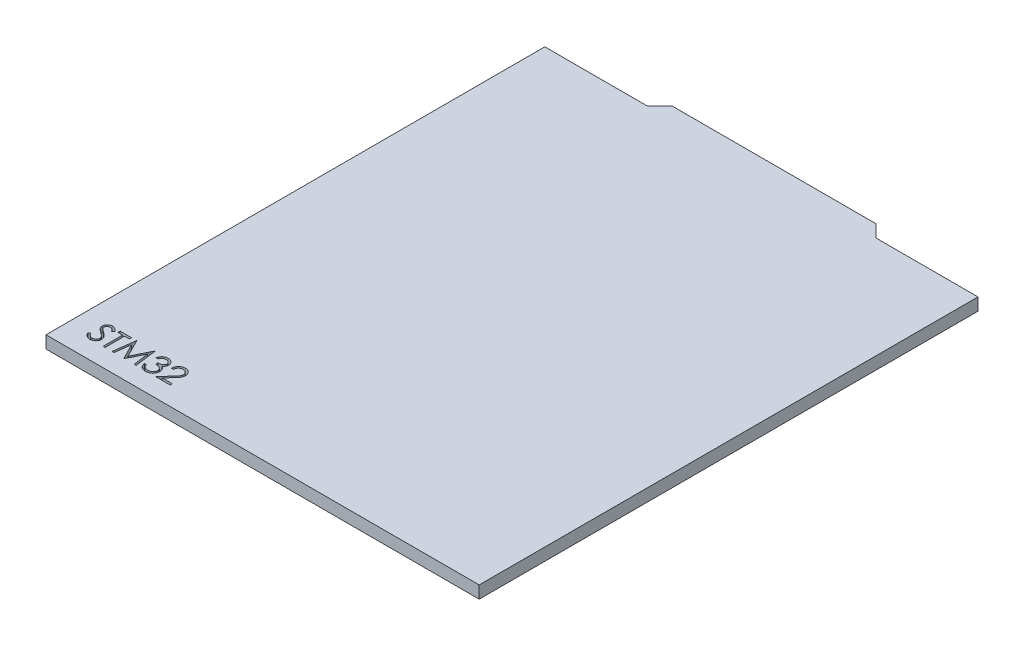
from build123d import *

# Parameters (mm, degrees)
BOSS_EXTRUDE1_DEPTH = 2
CUT_EXTRUDE1_DEPTH  = 1


with BuildPart() as part:
    # Sketch1 → Boss-Extrude1 (new body)
    with BuildSketch(Plane(origin=(0, 0, 0), x_dir=(1, 0, 0), z_dir=(0, 1, 0))):
        Polygon((16.5, 80.6), (18.5, 82.6), (51.5, 82.6), (53.5, 80.6), (70, 80.6), (70, 0), (0, 0), (0, 80.6), align=None)
    extrude(amount=BOSS_EXTRUDE1_DEPTH)

    # Sketch2 → Cut-Extrude1 (cut)
    with BuildSketch(Plane(origin=(0, 2, 0), x_dir=(1, 0, 0), z_dir=(0, 1, 0))):
        with BuildLine():
            Line((3.08974359, 3.675180288), (3.385616987, 3.852564103))
            add(Edge.make_bspline(
                [(3.385616987, 3.852564103), (3.413135224, 3.806499718), (3.465859105, 3.718242134), (3.553810464, 3.598984093), (3.644943375, 3.497621937), (3.739932709, 3.414745329), (3.838198657, 3.349496442), (3.940382711, 3.303294211), (4.046140521, 3.274478235), (4.118114343, 3.270978149), (4.154046474, 3.269230769)],
                knots=[0, 0, 0, 0, 1.272034388, 2.437168799, 3.508375237, 4.49857839, 5.41946034, 6.295179144, 7.148887113, 8, 8, 8, 8], degree=3))
            add(Edge.make_bspline(
                [(4.154046474, 3.269230769), (4.184733335, 3.270085442), (4.245570108, 3.271779832), (4.335132351, 3.288060634), (4.422114153, 3.313072763), (4.504722791, 3.348893694), (4.581818405, 3.39223218), (4.649425101, 3.444578358), (4.707871214, 3.503184563), (4.755680328, 3.568567218), (4.792360364, 3.638884367), (4.820552432, 3.711060318), (4.836197506, 3.786228886), (4.838554259, 3.836839349), (4.83974359, 3.862379808)],
                knots=[0, 0, 0, 0, 1.095163259, 2.171163733, 3.241058638, 4.321873601, 5.38011039, 6.391990106, 7.366004449, 8.327778327, 9.272591725, 10.192022065, 11.087607919, 12, 12, 12, 12], degree=3))
            add(Edge.make_bspline(
                [(4.83974359, 3.862379808), (4.838269279, 3.891520657), (4.835272221, 3.950759747), (4.809940741, 4.0381594), (4.770091494, 4.12465197), (4.73332885, 4.178153235), (4.714242788, 4.205929487)],
                knots=[0, 0, 0, 0, 0.938893495, 1.908633276, 2.914225137, 4, 4, 4, 4], degree=3))
            add(Edge.make_bspline(
                [(4.714242788, 4.205929487), (4.698572174, 4.225976311), (4.66567368, 4.268062109), (4.609116167, 4.330707345), (4.542750053, 4.395325764), (4.468846498, 4.464384821), (4.384713409, 4.534672617), (4.292985895, 4.609540895), (4.191322036, 4.686142472), (4.120022539, 4.737515038), (4.083233173, 4.764022436)],
                knots=[0, 0, 0, 0, 0.722233717, 1.516239348, 2.393582979, 3.351407094, 4.387010283, 5.505090956, 6.712668013, 8, 8, 8, 8], degree=3))
            add(Edge.make_bspline(
                [(4.083233173, 4.764022436), (4.046409177, 4.790251024), (3.9760045, 4.840398086), (3.877545918, 4.91482237), (3.789501455, 4.982866239), (3.712262438, 5.045170251), (3.645862842, 5.101742856), (3.589779431, 5.152040795), (3.545440873, 5.197424356), (3.520785293, 5.226865698), (3.509715545, 5.240084135)],
                knots=[0, 0, 0, 0, 1.452282411, 2.77665338, 3.964542531, 5.026858415, 5.96415736, 6.766646006, 7.446254459, 8, 8, 8, 8], degree=3))
            add(Edge.make_bspline(
                [(3.509715545, 5.240084135), (3.494243, 5.260685171), (3.463814163, 5.301199875), (3.423648157, 5.364524733), (3.389508995, 5.429347998), (3.362746663, 5.495843863), (3.340210444, 5.563078792), (3.325052513, 5.631930038), (3.315561116, 5.702088656), (3.31458913, 5.749302157), (3.314102564, 5.772936699)],
                knots=[0, 0, 0, 0, 1.068054152, 2.10047183, 3.106115577, 4.101338837, 5.06977816, 6.043150881, 7.020423561, 8, 8, 8, 8], degree=3))
            add(Edge.make_bspline(
                [(3.314102564, 5.772936699), (3.315407773, 5.809966473), (3.317990293, 5.883234537), (3.33983081, 5.990265367), (3.374303704, 6.092451785), (3.422598592, 6.188782118), (3.484855945, 6.276748099), (3.556901919, 6.357361586), (3.642713405, 6.425130168), (3.736866029, 6.484342227), (3.839922401, 6.530688152), (3.947913304, 6.565649132), (4.061010376, 6.58545839), (4.137613511, 6.588301155), (4.176482372, 6.58974359)],
                knots=[0, 0, 0, 0, 1.005424448, 1.989358655, 2.955360095, 3.929531133, 4.905563448, 5.876582895, 6.856512386, 7.866279853, 8.892233794, 9.918561126, 10.94386622, 12, 12, 12, 12], degree=3))
            add(Edge.make_bspline(
                [(4.176482372, 6.58974359), (4.217726472, 6.588321038), (4.299747824, 6.585492037), (4.420397039, 6.560894506), (4.536557756, 6.520193834), (4.630001021, 6.474005176), (4.703133782, 6.42787376), (4.758906515, 6.385853936), (4.815423966, 6.337478827), (4.87314202, 6.282619581), (4.93108268, 6.22077283), (4.990106132, 6.152362141), (5.050350401, 6.077805585), (5.089106261, 6.024581085), (5.108974359, 5.997295673)],
                knots=[0, 0, 0, 0, 1.286793592, 2.559021753, 3.825965368, 5.121522368, 5.803751409, 6.523245864, 7.299691795, 8.125521123, 9.008227632, 9.944561021, 10.946284179, 12, 12, 12, 12], degree=3))
            Line((5.108974359, 5.997295673), (4.825020032, 5.782051282))
            add(Edge.make_bspline(
                [(4.825020032, 5.782051282), (4.8078741, 5.804139972), (4.774855043, 5.846677626), (4.724725556, 5.906248941), (4.677476908, 5.960665421), (4.630926508, 6.007930549), (4.587532876, 6.050632682), (4.545415834, 6.087192439), (4.505181483, 6.117968034), (4.454464572, 6.150811594), (4.390746854, 6.183368098), (4.310762318, 6.210917176), (4.227176043, 6.227472238), (4.170246411, 6.229661126), (4.141426282, 6.230769231)],
                knots=[0, 0, 0, 0, 1.181633172, 2.275549214, 3.290209073, 4.226197932, 5.078386478, 5.862611352, 6.581680152, 7.217281963, 8.414376989, 9.595101626, 10.782541182, 12, 12, 12, 12], degree=3))
            add(Edge.make_bspline(
                [(4.141426282, 6.230769231), (4.10526976, 6.229557531), (4.035545312, 6.227220882), (3.936555076, 6.201700896), (3.847461151, 6.161519036), (3.770908586, 6.105204058), (3.707171609, 6.038483065), (3.66106615, 5.96170421), (3.633315986, 5.876921808), (3.629929706, 5.817780151), (3.628205128, 5.787660256)],
                knots=[0, 0, 0, 0, 1.14458467, 2.207223713, 3.21896685, 4.227309161, 5.202851033, 6.127160689, 7.046193047, 8, 8, 8, 8], degree=3))
            add(Edge.make_bspline(
                [(3.628205128, 5.787660256), (3.628598255, 5.768908778), (3.629385151, 5.731375158), (3.640359949, 5.675923736), (3.654459278, 5.620612397), (3.676801909, 5.565689814), (3.707647213, 5.510195455), (3.748152389, 5.453173718), (3.799165701, 5.394122009), (3.838242713, 5.355714635), (3.858874199, 5.335436699)],
                knots=[0, 0, 0, 0, 0.858281714, 1.717966888, 2.583508476, 3.4729293, 4.427298488, 5.488583878, 6.674047936, 8, 8, 8, 8], degree=3))
            add(Edge.make_bspline(
                [(3.858874199, 5.335436699), (3.866535571, 5.328599673), (3.884737238, 5.312356465), (3.918013164, 5.285764184), (3.961955962, 5.252961412), (4.015418163, 5.212374095), (4.079385525, 5.165292633), (4.153865081, 5.112319021), (4.238026614, 5.051733562), (4.29774853, 5.009376021), (4.329326923, 4.986979167)],
                knots=[0, 0, 0, 0, 0.420754252, 0.999615792, 1.744751191, 2.668019286, 3.750313428, 4.999500688, 6.413464383, 8, 8, 8, 8], degree=3))
            add(Edge.make_bspline(
                [(4.329326923, 4.986979167), (4.367312836, 4.959337807), (4.440867293, 4.905814145), (4.545524873, 4.825398465), (4.640418681, 4.746750697), (4.725881884, 4.67037309), (4.802758793, 4.596844997), (4.870196513, 4.525281816), (4.928882194, 4.456196244), (4.992061412, 4.367623668), (5.056619232, 4.258842584), (5.112060739, 4.125564345), (5.147019087, 3.991768025), (5.151590602, 3.901841188), (5.153846154, 3.857471955)],
                knots=[0, 0, 0, 0, 1.163667725, 2.253281268, 3.268753668, 4.215851969, 5.092017293, 5.902905408, 6.650798638, 7.335211899, 8.59617414, 9.77448103, 10.901945474, 12, 12, 12, 12], degree=3))
            add(Edge.make_bspline(
                [(5.153846154, 3.857471955), (5.153189016, 3.82609359), (5.151887501, 3.763946206), (5.136926587, 3.67269113), (5.115006922, 3.58406026), (5.081969688, 3.499149147), (5.04164653, 3.416404385), (4.990480282, 3.337996484), (4.931172597, 3.262190086), (4.863138832, 3.191006594), (4.78869293, 3.125660398), (4.710009235, 3.067531337), (4.626958962, 3.019063014), (4.539992645, 2.979512172), (4.449090309, 2.948578654), (4.354282525, 2.926165785), (4.255413014, 2.912410074), (4.188212532, 2.910982313), (4.154046474, 2.91025641)],
                knots=[0, 0, 0, 0, 0.983748083, 1.948392443, 2.894712957, 3.844097841, 4.80183111, 5.778335162, 6.776009319, 7.81870978, 8.863265674, 9.881300176, 10.883814829, 11.87499822, 12.874611388, 13.892143829, 14.928324115, 16, 16, 16, 16], degree=3))
            add(Edge.make_bspline(
                [(4.154046474, 2.91025641), (4.127611131, 2.910767592), (4.075073371, 2.911783517), (3.997363889, 2.920764798), (3.9212243, 2.933471901), (3.847610018, 2.953645971), (3.775572607, 2.978122948), (3.705425372, 3.008261281), (3.637134318, 3.044378482), (3.570316735, 3.085673507), (3.505142561, 3.133731252), (3.442223093, 3.189704748), (3.379493907, 3.252050253), (3.318806511, 3.322460816), (3.258933367, 3.399798899), (3.201054957, 3.484788083), (3.143973239, 3.576965436), (3.108157772, 3.641830522), (3.08974359, 3.675180288)],
                knots=[0, 0, 0, 0, 0.915332311, 1.819136955, 2.706846663, 3.586547465, 4.459518054, 5.340707479, 6.227863349, 7.133153174, 8.059268498, 9.028702269, 10.047606654, 11.120612155, 12.245963614, 13.433783089, 14.680604001, 16, 16, 16, 16], degree=3))
        make_face()
        Polygon((5.467948718, 6.141025641), (5.467948718, 6.5), (7.307692308, 6.5), (7.307692308, 6.141025641), (6.544871795, 6.141025641), (6.544871795, 3), (6.230769231, 3), (6.230769231, 6.141025641), align=None)
        Polygon((7.666666667, 3), (8.128705929, 6.5), (8.173577724, 6.5), (9.618589744, 3.628205128), (11.059395032, 6.5), (11.104266827, 6.5), (11.570512821, 3), (11.256410256, 3), (10.919871795, 5.516326122), (9.657151442, 3), (9.585637019, 3), (8.317307692, 5.524038462), (7.982872596, 3), align=None)
        with BuildLine():
            Line((12.423076923, 5.692307692), (12.108974359, 5.692307692))
            add(Edge.make_bspline(
                [(12.108974359, 5.692307692), (12.11748391, 5.727540176), (12.134119385, 5.796416801), (12.168816959, 5.894824062), (12.206616214, 5.987947583), (12.252005318, 6.074043657), (12.301514073, 6.154842559), (12.358236794, 6.228511684), (12.419556517, 6.296924649), (12.487381466, 6.357637887), (12.558510128, 6.412615616), (12.633944747, 6.459490673), (12.712167641, 6.499814826), (12.793720774, 6.533035058), (12.878846946, 6.558060582), (12.966776569, 6.576217387), (13.057740069, 6.588008502), (13.11948766, 6.589159265), (13.150841346, 6.58974359)],
                knots=[0, 0, 0, 0, 1.162005537, 2.271625781, 3.343758855, 4.383309926, 5.390229558, 6.379919256, 7.361854164, 8.333198761, 9.295911338, 10.242430842, 11.177959212, 12.116337295, 13.062827104, 14.020064771, 14.994644689, 16, 16, 16, 16], degree=3))
            add(Edge.make_bspline(
                [(13.150841346, 6.58974359), (13.196524088, 6.588364359), (13.286893099, 6.585635984), (13.419656146, 6.560721548), (13.547682965, 6.521296415), (13.669572213, 6.466822688), (13.782790646, 6.399635375), (13.883526832, 6.319670638), (13.970415343, 6.228471337), (14.043309721, 6.127738772), (14.10038472, 6.020083263), (14.142471093, 5.909283106), (14.168092774, 5.795601134), (14.171413331, 5.718843855), (14.173076923, 5.680388622)],
                knots=[0, 0, 0, 0, 1.083050992, 2.142477498, 3.193116406, 4.255571735, 5.30263384, 6.308962982, 7.297363603, 8.282367274, 9.249857812, 10.179914175, 11.08814088, 12, 12, 12, 12], degree=3))
            add(Edge.make_bspline(
                [(14.173076923, 5.680388622), (14.171913332, 5.643381827), (14.169636365, 5.570965273), (14.150302659, 5.465243775), (14.117766396, 5.365602175), (14.072696634, 5.271621013), (14.014355084, 5.183896173), (13.943682387, 5.102230282), (13.860179725, 5.026261124), (13.796900787, 4.982741651), (13.764322917, 4.960336538)],
                knots=[0, 0, 0, 0, 1.024540389, 2.004866551, 2.965041327, 3.920577974, 4.882998113, 5.874504559, 6.905732034, 8, 8, 8, 8], degree=3))
            add(Edge.make_bspline(
                [(13.764322917, 4.960336538), (13.801554671, 4.942358367), (13.875321546, 4.906738409), (13.975872075, 4.836882652), (14.06714995, 4.756226304), (14.118053669, 4.693283652), (14.143629808, 4.661658654)],
                knots=[0, 0, 0, 0, 1.015518401, 2.012035669, 3.001164323, 4, 4, 4, 4], degree=3))
            add(Edge.make_bspline(
                [(14.143629808, 4.661658654), (14.16047115, 4.638600902), (14.193878046, 4.592862986), (14.23511358, 4.51932656), (14.272522694, 4.444975071), (14.301672913, 4.367815664), (14.32424678, 4.288742651), (14.340382813, 4.207620255), (14.350406953, 4.124382232), (14.351842505, 4.068069752), (14.352564103, 4.039763622)],
                knots=[0, 0, 0, 0, 1.025084078, 2.033381695, 3.024893161, 4.013698104, 4.991890475, 5.976764909, 6.982997093, 8, 8, 8, 8], degree=3))
            add(Edge.make_bspline(
                [(14.352564103, 4.039763622), (14.350769589, 3.990753901), (14.347189007, 3.892965099), (14.315184933, 3.748490377), (14.265571692, 3.607264875), (14.195114756, 3.472190036), (14.109247247, 3.345809655), (14.007089923, 3.232733346), (13.889803515, 3.135534741), (13.758997866, 3.054324513), (13.617280737, 2.989406591), (13.465705145, 2.944349148), (13.306455091, 2.915003148), (13.197247794, 2.91185628), (13.141726763, 2.91025641)],
                knots=[0, 0, 0, 0, 0.955779014, 1.907060117, 2.875433937, 3.871313158, 4.872415639, 5.851225146, 6.836215519, 7.83643374, 8.849228613, 9.86973379, 10.916971861, 12, 12, 12, 12], degree=3))
            add(Edge.make_bspline(
                [(13.141726763, 2.91025641), (13.104307463, 2.911124624), (13.030678757, 2.912832978), (12.922435259, 2.924511579), (12.81911356, 2.945841584), (12.720573962, 2.974544889), (12.626728925, 3.010936632), (12.53786482, 3.05625533), (12.453434927, 3.109566832), (12.374235976, 3.171500419), (12.300277408, 3.240781759), (12.233524684, 3.318640769), (12.172864891, 3.403638173), (12.119922252, 3.496761229), (12.072285299, 3.596806487), (12.033104343, 3.705054985), (11.998618774, 3.820539007), (11.98258531, 3.901016747), (11.974358974, 3.942307692)],
                knots=[0, 0, 0, 0, 1.048658725, 2.063410685, 3.046034179, 4.001477787, 4.936774919, 5.862367409, 6.792675028, 7.730719943, 8.675894397, 9.627829632, 10.600096036, 11.597688215, 12.626045268, 13.701542398, 14.82072376, 16, 16, 16, 16], degree=3))
            Line((11.974358974, 3.942307692), (12.288461538, 3.942307692))
            add(Edge.make_bspline(
                [(12.288461538, 3.942307692), (12.29664483, 3.915358679), (12.312562043, 3.862940507), (12.339656341, 3.787500202), (12.370524613, 3.718342149), (12.403639171, 3.654959027), (12.438417617, 3.596726624), (12.477332542, 3.545184755), (12.517501688, 3.498069553), (12.547781041, 3.471524941), (12.56260016, 3.458533654)],
                knots=[0, 0, 0, 0, 1.198163088, 2.33053128, 3.407730985, 4.417276592, 5.372219308, 6.28897303, 7.162600585, 8, 8, 8, 8], degree=3))
            add(Edge.make_bspline(
                [(12.56260016, 3.458533654), (12.582196737, 3.44342532), (12.6213294, 3.413255288), (12.685097631, 3.37475366), (12.752162517, 3.341392634), (12.823977191, 3.315908939), (12.898991962, 3.294331278), (12.978419327, 3.280210759), (13.061558544, 3.270522587), (13.118326307, 3.269667656), (13.147335737, 3.269230769)],
                knots=[0, 0, 0, 0, 0.946170439, 1.889420265, 2.845303464, 3.807233317, 4.801018734, 5.828864929, 6.890507805, 8, 8, 8, 8], degree=3))
            add(Edge.make_bspline(
                [(13.147335737, 3.269230769), (13.18008924, 3.269846674), (13.244135887, 3.271051024), (13.337590746, 3.282126731), (13.426498194, 3.298257144), (13.509871119, 3.323170127), (13.588801627, 3.353950979), (13.662183276, 3.392599384), (13.730979383, 3.437944106), (13.794308788, 3.489483264), (13.851254296, 3.545904759), (13.901393809, 3.60491783), (13.94401847, 3.66627366), (13.978402048, 3.730311781), (14.005552599, 3.79676701), (14.024035799, 3.865825839), (14.036887314, 3.936923105), (14.037933927, 3.985252074), (14.038461538, 4.009615385)],
                knots=[0, 0, 0, 0, 1.217147791, 2.380027433, 3.494444702, 4.572153297, 5.609568379, 6.639424714, 7.649109417, 8.668170816, 9.669597737, 10.625200337, 11.543417969, 12.441394052, 13.322311151, 14.205496177, 15.095365482, 16, 16, 16, 16], degree=3))
            add(Edge.make_bspline(
                [(14.038461538, 4.009615385), (14.036931237, 4.042226723), (14.033878248, 4.107287132), (14.010569669, 4.203004706), (13.972230805, 4.295228118), (13.918558293, 4.382383909), (13.853222565, 4.46315981), (13.776857658, 4.535231293), (13.68882943, 4.594701384), (13.607809561, 4.63579004), (13.536044404, 4.663827115), (13.47462902, 4.68250208), (13.405872416, 4.698315735), (13.330606067, 4.713028007), (13.248262851, 4.725549355), (13.158932413, 4.735991171), (13.062596651, 4.744346212), (12.995905485, 4.748077307), (12.961538462, 4.75)],
                knots=[0, 0, 0, 0, 1.07054697, 2.135767047, 3.216561865, 4.33974944, 5.486079747, 6.621378074, 7.775625952, 8.963672916, 9.598146892, 10.304877434, 11.070270905, 11.915000392, 12.823868403, 13.805723172, 14.86925407, 16, 16, 16, 16], degree=3))
            Line((12.961538462, 4.75), (12.961538462, 5.108974359))
            add(Edge.make_bspline(
                [(12.961538462, 5.108974359), (13.004839627, 5.109709163), (13.089655974, 5.111148463), (13.213550279, 5.128556473), (13.332023591, 5.152637101), (13.442450333, 5.189522293), (13.543099046, 5.23236259), (13.630418648, 5.2822148), (13.703185795, 5.337629549), (13.761046867, 5.399462158), (13.804576096, 5.465777206), (13.836402893, 5.534893864), (13.855203219, 5.607417924), (13.857712886, 5.656912592), (13.858974359, 5.681790865)],
                knots=[0, 0, 0, 0, 1.321986639, 2.589447074, 3.816329219, 5.01088745, 6.139805852, 7.153945165, 8.075214402, 8.924034688, 9.728124013, 10.488707548, 11.240355623, 12, 12, 12, 12], degree=3))
            add(Edge.make_bspline(
                [(13.858974359, 5.681790865), (13.858559948, 5.700068611), (13.857735497, 5.736431318), (13.847338219, 5.789556386), (13.831714178, 5.841057332), (13.810234449, 5.890715142), (13.78148425, 5.938185416), (13.747078264, 5.983872865), (13.706110163, 6.027516644), (13.659164716, 6.068196964), (13.608752911, 6.106966201), (13.553503136, 6.139879838), (13.495081262, 6.1680249), (13.433422607, 6.191234402), (13.368327077, 6.20869369), (13.300100519, 6.221229532), (13.228612835, 6.229067187), (13.179841103, 6.230195602), (13.155048077, 6.230769231)],
                knots=[0, 0, 0, 0, 0.884392785, 1.759457502, 2.611959086, 3.489218968, 4.37281399, 5.2945488, 6.255912374, 7.266815255, 8.301784654, 9.332968512, 10.37626691, 11.440494194, 12.520033166, 13.637162961, 14.798855837, 16, 16, 16, 16], degree=3))
            add(Edge.make_bspline(
                [(13.155048077, 6.230769231), (13.115196409, 6.229377869), (13.037356833, 6.226660215), (12.925141916, 6.202857202), (12.820822582, 6.164879118), (12.741083915, 6.119546099), (12.682201341, 6.074795665), (12.640124403, 6.035713279), (12.598803892, 5.992280455), (12.560958215, 5.94182208), (12.522684239, 5.887755289), (12.487839677, 5.827331608), (12.453979985, 5.762127214), (12.433577435, 5.716031579), (12.423076923, 5.692307692)],
                knots=[0, 0, 0, 0, 1.472543308, 2.876219568, 4.221790263, 5.565193594, 6.249813518, 6.953379497, 7.687249741, 8.463570142, 9.283606569, 10.136032583, 11.040678096, 12, 12, 12, 12], degree=3))
        make_face()
        with BuildLine():
            Line((15.115384615, 5.423076923), (14.801282051, 5.423076923))
            add(Edge.make_bspline(
                [(14.801282051, 5.423076923), (14.803329204, 5.464747811), (14.807349758, 5.546588325), (14.826178048, 5.665912232), (14.853118925, 5.779967031), (14.891210379, 5.887836945), (14.938516657, 5.990475752), (14.995246684, 6.087475767), (15.062440534, 6.178466956), (15.138647269, 6.262605799), (15.221415908, 6.33979337), (15.310721847, 6.406448613), (15.404566874, 6.462766284), (15.502666273, 6.509847526), (15.606126837, 6.545187372), (15.714009695, 6.571409012), (15.826788831, 6.587185357), (15.903628853, 6.588881143), (15.942708333, 6.58974359)],
                knots=[0, 0, 0, 0, 1.10065271, 2.161652631, 3.183658789, 4.190468796, 5.17591951, 6.163126047, 7.15150782, 8.156236427, 9.156009102, 10.134482811, 11.092018607, 12.041330605, 13.001268258, 13.972401359, 14.968799086, 16, 16, 16, 16], degree=3))
            add(Edge.make_bspline(
                [(15.942708333, 6.58974359), (15.981086407, 6.588845133), (16.056497952, 6.587079698), (16.166559967, 6.571918669), (16.271337261, 6.548173078), (16.370625028, 6.514857661), (16.463631092, 6.470073234), (16.551054137, 6.416275695), (16.633934947, 6.354055864), (16.708541731, 6.28080205), (16.77704981, 6.202599666), (16.836152065, 6.119111762), (16.886765229, 6.032882477), (16.928952909, 5.943254275), (16.960009048, 5.849383247), (16.983587256, 5.752636044), (16.996914669, 5.652011233), (16.998960093, 5.583904677), (17, 5.549278846)],
                knots=[0, 0, 0, 0, 1.111607364, 2.184268762, 3.212621178, 4.221274766, 5.211760367, 6.196651075, 7.1921475, 8.207485113, 9.220403448, 10.201281604, 11.166441695, 12.114753415, 13.065576456, 14.026450734, 14.996634279, 16, 16, 16, 16], degree=3))
            add(Edge.make_bspline(
                [(17, 5.549278846), (16.998313355, 5.500529037), (16.994969663, 5.403884909), (16.966113961, 5.261680551), (16.921531864, 5.123775492), (16.867458835, 5.01279644), (16.812838267, 4.923819547), (16.764658471, 4.849903905), (16.707006119, 4.771077489), (16.640408705, 4.68654638), (16.565870899, 4.59605201), (16.482856231, 4.499557244), (16.390730541, 4.398086939), (16.326072359, 4.328781126), (16.292568109, 4.29286859)],
                knots=[0, 0, 0, 0, 1.184203166, 2.347625244, 3.513805382, 4.700623107, 5.337941753, 6.051866363, 6.845199593, 7.711357327, 8.668078039, 9.695487809, 10.805859518, 12, 12, 12, 12], degree=3))
            Line((16.292568109, 4.29286859), (15.416866987, 3.358974359))
            Line((15.416866987, 3.358974359), (17.044871795, 3.358974359))
            Line((17.044871795, 3.358974359), (17.044871795, 3))
            Line((17.044871795, 3), (14.666666667, 3))
            Line((14.666666667, 3), (16.024038462, 4.448517628))
            add(Edge.make_bspline(
                [(16.024038462, 4.448517628), (16.057086348, 4.483015935), (16.120564575, 4.549280121), (16.210347152, 4.646023081), (16.290986141, 4.735772622), (16.363003533, 4.818359171), (16.424837039, 4.894990738), (16.479709271, 4.963185442), (16.523674862, 5.025939892), (16.571390257, 5.098680506), (16.617604239, 5.187492823), (16.657316595, 5.296026513), (16.681531443, 5.407753765), (16.684436279, 5.483255802), (16.685897436, 5.521233974)],
                knots=[0, 0, 0, 0, 1.329631726, 2.553950428, 3.673215718, 4.687767853, 5.603093632, 6.413772471, 7.123043292, 7.734684054, 8.834405432, 9.900288307, 10.943827018, 12, 12, 12, 12], degree=3))
            add(Edge.make_bspline(
                [(16.685897436, 5.521233974), (16.685261694, 5.545115373), (16.684008768, 5.592181023), (16.67295107, 5.661186782), (16.656240564, 5.727751596), (16.632295306, 5.792080215), (16.600688566, 5.853525867), (16.562215186, 5.912163347), (16.517825123, 5.968852313), (16.466473853, 6.022005611), (16.410062333, 6.070686816), (16.350468084, 6.113810902), (16.28741798, 6.149850012), (16.221177857, 6.179393509), (16.151932388, 6.202568891), (16.079547643, 6.21862747), (16.004223627, 6.228709954), (15.952790131, 6.230074126), (15.926582532, 6.230769231)],
                knots=[0, 0, 0, 0, 0.991446411, 1.95395049, 2.89581595, 3.838931463, 4.798493298, 5.75982156, 6.748411868, 7.785213223, 8.824556874, 9.840280684, 10.836137867, 11.835679398, 12.848801643, 13.863922112, 14.911575587, 16, 16, 16, 16], degree=3))
            add(Edge.make_bspline(
                [(15.926582532, 6.230769231), (15.899211699, 6.230054199), (15.845459903, 6.228649993), (15.76654087, 6.218827329), (15.691255093, 6.201881489), (15.61941319, 6.178704814), (15.550893604, 6.149246266), (15.48602956, 6.112554521), (15.424966671, 6.068771028), (15.367590147, 6.019130471), (15.314726168, 5.96386287), (15.268279292, 5.902252907), (15.227695278, 5.835425492), (15.192286045, 5.763560941), (15.163530355, 5.686007161), (15.141557204, 5.603039456), (15.124170357, 5.515018075), (15.118361837, 5.45423299), (15.115384615, 5.423076923)],
                knots=[0, 0, 0, 0, 1.031018746, 2.02475058, 2.990194455, 3.934040569, 4.864654155, 5.795059489, 6.735614925, 7.690564532, 8.649604399, 9.611025574, 10.590972636, 11.591080095, 12.624614302, 13.701020113, 14.821632451, 16, 16, 16, 16], degree=3))
        make_face()
    extrude(amount=-CUT_EXTRUDE1_DEPTH, mode=Mode.SUBTRACT)


solid = part.part
